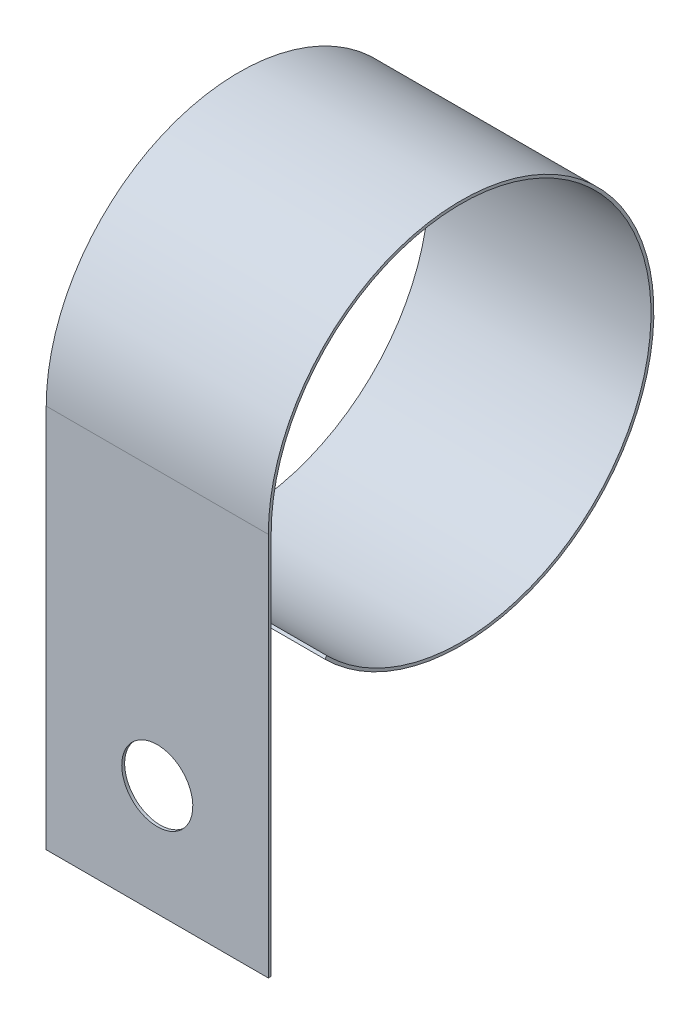
from build123d import *

# Parameters (mm, degrees)
BOSS_EXTRUDE1_DEPTH = 5
CUT_EXTRUDE1_REACH  = 27.013
SKETCH2_R           = 1.6


with BuildPart() as part:
    # Sketch1 → Boss-Extrude1 (new, symmetric)
    with BuildSketch(Plane(origin=(0, 0, 0), x_dir=(0, -1, 0), z_dir=(1, 0, 0))):
        with BuildLine():
            Line((6.137686861, -6.137686861), (6.045762979, -6.045762979))
            ThreePointArc((6.045762979, -6.045762979), (-3.271943347, 7.899170003), (0, -8.55))
            Line((0, -8.55), (17.3, -8.55))
            Line((17.3, -8.55), (17.3, -8.68))
            Line((17.3, -8.68), (0, -8.68))
            ThreePointArc((0, -8.68), (-3.321692193, 8.019274342), (6.137686861, -6.137686861))
        make_face()
    extrude(amount=BOSS_EXTRUDE1_DEPTH, both=True)

    # Sketch2 → Cut-Extrude1 (cut, up to next)
    with BuildSketch(Plane(origin=(0, 0, 8.68), x_dir=(-1, 0, 0), z_dir=(0, 0, -1)), mode=Mode.PRIVATE) as cut_extrude1_sk1:
        with Locations(Location((0, -12.3, 0), (0, 0, 270))):
            Circle(SKETCH2_R)
    cut_extrude1_tool1 = extrude(cut_extrude1_sk1.sketch, amount=CUT_EXTRUDE1_REACH, mode=Mode.PRIVATE) & part.part
    add(cut_extrude1_tool1.solids().sort_by_distance((0, -12.3, 8.68))[0], mode=Mode.SUBTRACT)


solid = part.part
